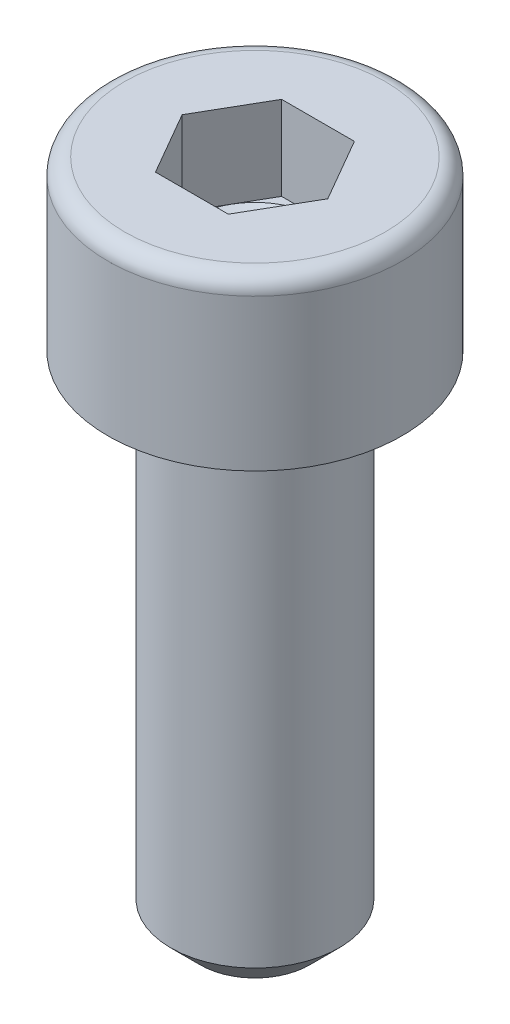
from build123d import *

# Parameters (mm, degrees)
TIGE_START              = -12
ESQUISSE1_R             = 2
TIGE_DEPTH              = 12
CHANFREIN_D_ENTR_E_SIZE = 0.7
HEXAGONE_DEPTH          = 2


with BuildPart() as part:
    # Esquisse1 → Tige (new body)
    with BuildSketch(Plane(origin=(0, 0, 0), x_dir=(1, 0, 0), z_dir=(0, 1, 0)).offset(TIGE_START)):
        with Locations(Location((0, 0, 0), (0, 0, 270))):
            Circle(ESQUISSE1_R)
    extrude(amount=TIGE_DEPTH)

    # Chanfrein d'entrée
    chanfrein_d_entr_e_edges = [part.edges().sort_by_distance(p)[0] for p in [
        (0, -12, -2),
    ]]
    chamfer(chanfrein_d_entr_e_edges, length=CHANFREIN_D_ENTR_E_SIZE)

    # Esquisse2 → Tête (revolve)
    with BuildSketch(Plane.XY, mode=Mode.PRIVATE) as t_te_sk:
        with BuildLine():
            Line((1.5, 4), (1.5, 2))
            Line((1.5, 2), (0, 1.133974596))
            Line((0, 1.133974596), (0, 0))
            Line((0, 0), (3.5, 0))
            Line((3.5, 0), (3.5, 3.6))
            ThreePointArc((3.5, 3.6), (3.382842712, 3.882842712), (3.1, 4))
            Line((3.1, 4), (1.5, 4))
        make_face()
    revolve(t_te_sk.sketch.rotate(Axis((0, 4, 0), (0, -1, 0)), 180), axis=Axis((0, 4, 0), (0, -1, 0)))

    # Esquisse3 → Hexagone (cut)
    with BuildSketch(Plane(origin=(0, 4, -3), x_dir=(1, 0, 0), z_dir=(0, -1, 0))):
        Polygon((0.866025404, 4.5), (-0.866025404, 4.5), (-1.732050808, 3), (-0.866025404, 1.5), (0.866025404, 1.5), (1.732050808, 3), align=None)
    extrude(amount=HEXAGONE_DEPTH, mode=Mode.SUBTRACT)


solid = part.part
